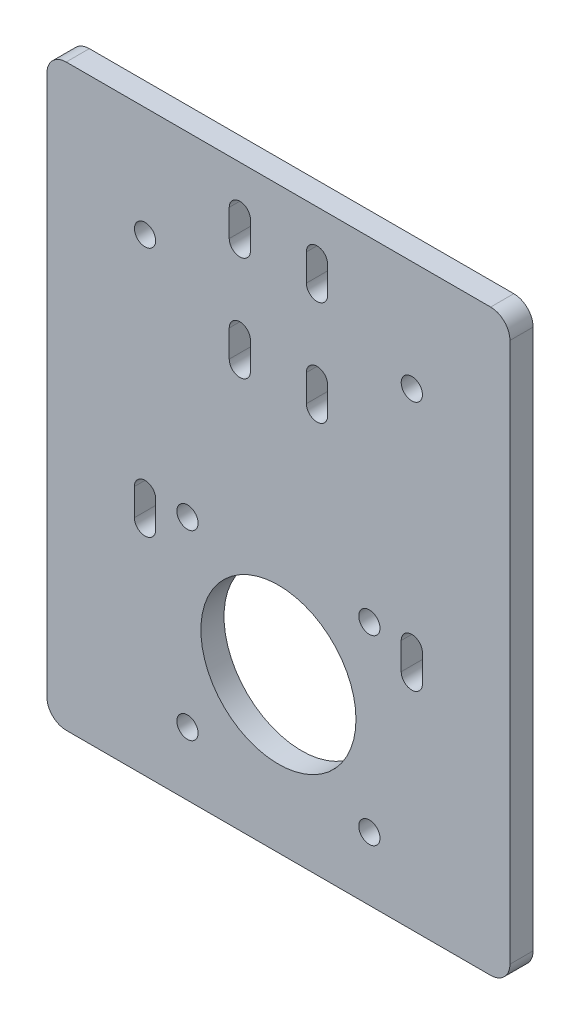
from build123d import *

# Parameters (mm, degrees)
BOSS_EXTRUDE1_DEPTH  = 6
SKETCH4_R            = 20.1
CUT_EXTRUDE1_DEPTH   = 6
M5_CLEARANCE_HOLE1_D = 5.5
CUT_EXTRUDE2_DEPTH   = 6
M5_CLEARANCE_HOLE2_D = 5.5
CUT_EXTRUDE3_DEPTH   = 6


with BuildPart() as part:
    # Sketch3 → Boss-Extrude1 (new body)
    with BuildSketch(Plane.XY):
        with BuildLine():
            Line((-55, -75), (55, -75))
            ThreePointArc((55, -75), (58.535533906, -73.535533906), (60, -70))
            Line((60, -70), (60, 70))
            ThreePointArc((60, 70), (58.535533906, 73.535533906), (55, 75))
            Line((55, 75), (-55, 75))
            ThreePointArc((-55, 75), (-58.535533906, 73.535533906), (-60, 70))
            Line((-60, 70), (-60, -70))
            ThreePointArc((-60, -70), (-58.535533906, -73.535533906), (-55, -75))
        make_face()
    extrude(amount=BOSS_EXTRUDE1_DEPTH)

    # Sketch4 → Cut-Extrude1 (cut)
    with BuildSketch(Plane.XY.offset(6)):
        with Locations((0, -35)):
            Circle(SKETCH4_R)
    extrude(amount=-CUT_EXTRUDE1_DEPTH, mode=Mode.SUBTRACT)

    # M5 Clearance Hole1 (through all)
    with Locations(Plane.XY.offset(6)):
        with Locations((-23.57, -11.43), (23.57, -11.43), (23.57, -58.57), (-23.57, -58.57)):
            Hole(M5_CLEARANCE_HOLE1_D / 2)

    # Sketch7 → Cut-Extrude2 (cut)
    with BuildSketch(Plane.XY.offset(6)):
        with BuildLine():
            Line((-31.82, -11.43), (-31.82, -18.43))
            ThreePointArc((-31.82, -18.43), (-34.57, -21.18), (-37.32, -18.43))
            Line((-37.32, -18.43), (-37.32, -11.43))
            ThreePointArc((-37.32, -11.43), (-34.57, -8.68), (-31.82, -11.43))
        make_face()
        with BuildLine():
            Line((31.82, -11.43), (31.82, -18.43))
            ThreePointArc((31.82, -18.43), (34.57, -21.18), (37.32, -18.43))
            Line((37.32, -18.43), (37.32, -11.43))
            ThreePointArc((37.32, -11.43), (34.57, -8.68), (31.82, -11.43))
        make_face()
    extrude(amount=-CUT_EXTRUDE2_DEPTH, mode=Mode.SUBTRACT)

    # M5 Clearance Hole2 (through all)
    with Locations(Plane.XY.offset(6)):
        with Locations((-34.57, 46.47), (34.57, 46.47)):
            Hole(M5_CLEARANCE_HOLE2_D / 2)

    # Sketch10 → Cut-Extrude3 (cut)
    with BuildSketch(Plane.XY.offset(6)):
        with BuildLine():
            Line((-7.25, 63.5), (-7.25, 56.5))
            ThreePointArc((-7.25, 56.5), (-10, 53.75), (-12.75, 56.5))
            Line((-12.75, 56.5), (-12.75, 63.5))
            ThreePointArc((-12.75, 63.5), (-10, 66.25), (-7.25, 63.5))
        make_face()
        with BuildLine():
            Line((12.75, 63.5), (12.75, 56.5))
            ThreePointArc((12.75, 56.5), (10, 53.75), (7.25, 56.5))
            Line((7.25, 56.5), (7.25, 63.5))
            ThreePointArc((7.25, 63.5), (10, 66.25), (12.75, 63.5))
        make_face()
        with BuildLine():
            Line((-7.25, 29.44), (-7.25, 36.44))
            ThreePointArc((-7.25, 36.44), (-10, 39.19), (-12.75, 36.44))
            Line((-12.75, 36.44), (-12.75, 29.44))
            ThreePointArc((-12.75, 29.44), (-10, 26.69), (-7.25, 29.44))
        make_face()
        with BuildLine():
            Line((12.75, 29.44), (12.75, 36.44))
            ThreePointArc((12.75, 36.44), (10, 39.19), (7.25, 36.44))
            Line((7.25, 36.44), (7.25, 29.44))
            ThreePointArc((7.25, 29.44), (10, 26.69), (12.75, 29.44))
        make_face()
    extrude(amount=-CUT_EXTRUDE3_DEPTH, mode=Mode.SUBTRACT)


solid = part.part
